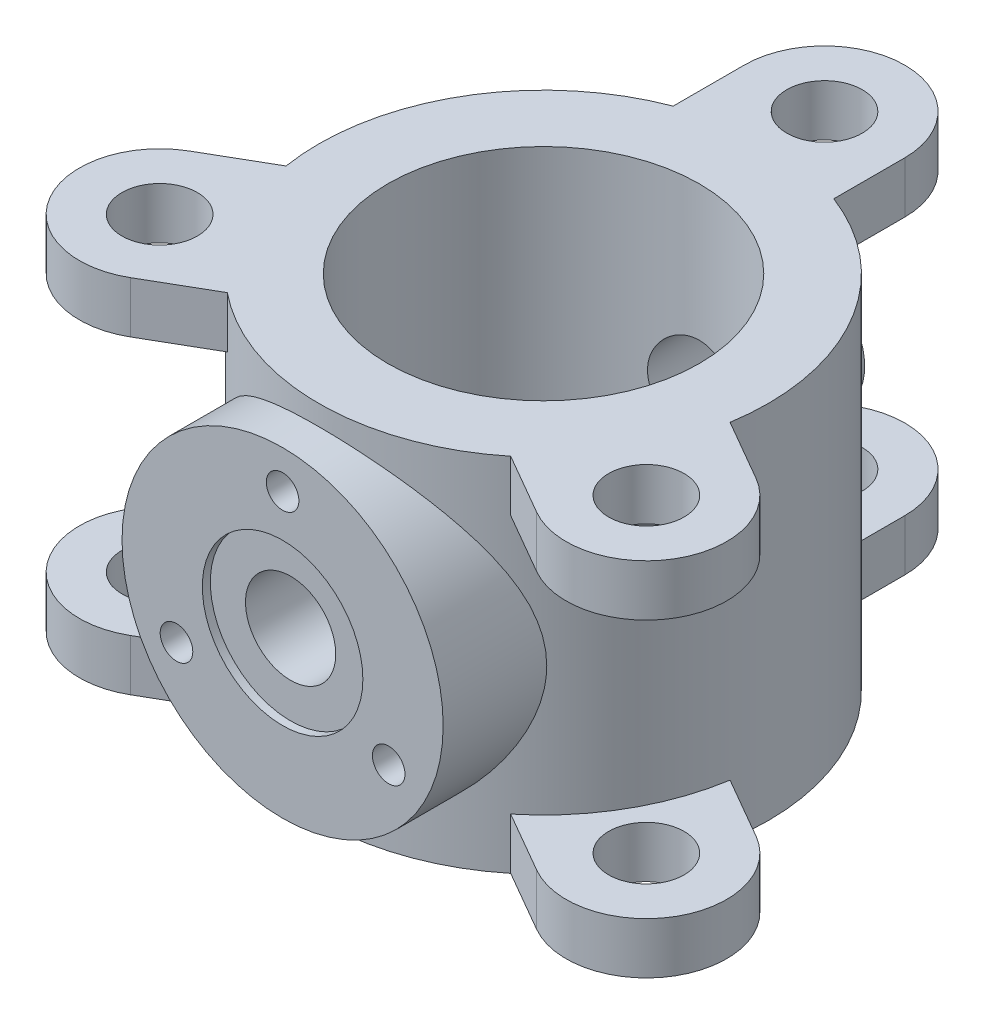
from build123d import *

# Parameters (mm, degrees)
SKETCH1_R                = 140
SKETCH1_R_2              = 97
BOSS_EXTRUDE1_DEPTH      = 112.5
BOSS_EXTRUDE2_REACH      = 353.799
BOSS_EXTRUDE2_END_RADIUS = 140
SKETCH2_R                = 100
BOSS_EXTRUDE3_REACH      = 373.324
BOSS_EXTRUDE3_END_RADIUS = 140
SKETCH3_R                = 37.5
HOLE1_D                  = 20.3
HOLE1_DEPTH              = 30
CIRPATTERN1_COUNT        = 3
HOLE2_D                  = 56.2
HOLE2_DEPTH              = 310
HOLE2_CBORE_D            = 100
HOLE2_CBORE_DEPTH        = 5
BOSS_EXTRUDE4_DEPTH      = 32
CIRPATTERN2_COUNT        = 3
SKETCH10_W               = 23.5
SKETCH10_H               = 32
HOLE3_AT_2_COUNT         = 2
HOLE3_AT_2_PITCH         = 303.108891325
HOLE3_AT_3_COUNT         = 2
HOLE3_AT_3_PITCH         = 303.108891325
MIRROR1_COPY_1_DEPTH     = 32
MIRROR1_COPY_2_DEPTH     = 32
MIRROR1_COPY_3_SKETCH_W  = 23.5
MIRROR1_COPY_3_SKETCH_H  = 32
MIRROR1_COPY_4_SKETCH_W  = 23.5
MIRROR1_COPY_4_SKETCH_H  = 32


with BuildPart() as part:
    # Sketch1 → Boss-Extrude1 (new, symmetric)
    with BuildSketch(Plane(origin=(0, 0, 0), x_dir=(1, 0, 0), z_dir=(0, 1, 0))):
        with Locations(Location((0, 0, 0), (0, 0, 270))):
            Circle(SKETCH1_R)
        with Locations(Location((0, 0, 0), (0, 0, 270))):
            Circle(SKETCH1_R_2, mode=Mode.SUBTRACT)
    extrude(amount=BOSS_EXTRUDE1_DEPTH, both=True)

    # Boss-Extrude2: up to this cylinder (the profile starts outside it)
    boss_extrude2_end = Plane(origin=(0, 0, 0), z_dir=(0, -1, 0)) * Cylinder(BOSS_EXTRUDE2_END_RADIUS, 988.598, mode=Mode.PRIVATE)
    # Sketch2 → Boss-Extrude2 (add, up to the surface)
    with BuildSketch(Plane.XY.offset(162.5), mode=Mode.PRIVATE) as boss_extrude2_sk1:
        Circle(SKETCH2_R)
    boss_extrude2_tool1 = extrude(boss_extrude2_sk1.sketch, amount=-BOSS_EXTRUDE2_REACH, mode=Mode.PRIVATE) - boss_extrude2_end
    add(boss_extrude2_tool1.solids().sort_by_distance((0, 0, 162.5))[0])

    # Boss-Extrude3: up to this cylinder (the profile starts outside it)
    boss_extrude3_end = Plane(origin=(0, 0, 0), z_dir=(0, -1, 0)) * Cylinder(BOSS_EXTRUDE3_END_RADIUS, 1027.648, mode=Mode.PRIVATE)
    # Sketch3 → Boss-Extrude3 (add, up to the surface)
    with BuildSketch(Plane.XY.offset(-162.5), mode=Mode.PRIVATE) as boss_extrude3_sk1:
        with Locations(Location((0, 0, 0), (0, 0, 90))):
            Circle(SKETCH3_R)
    boss_extrude3_tool1 = extrude(boss_extrude3_sk1.sketch, amount=BOSS_EXTRUDE3_REACH, mode=Mode.PRIVATE) - boss_extrude3_end
    add(boss_extrude3_tool1.solids().sort_by_distance((0, 0, -162.5))[0])

    # Hole1
    with Locations(Plane.XY.offset(162.5)):
        with Locations((0, 76.3)):
            hole1 = Hole(HOLE1_D / 2, depth=HOLE1_DEPTH)

    # CirPattern1: Hole1 ×3 about axis
    cirpattern1_axis = Axis((0, 0, 0), (0, 0, 1))
    for i in range(1, CIRPATTERN1_COUNT):
        add(hole1.rotate(cirpattern1_axis, i * 360 / CIRPATTERN1_COUNT), mode=Mode.SUBTRACT)

    # Hole2
    with Locations(Plane.XY.offset(162.5)):
        with Locations((0, 0)):
            CounterBoreHole(HOLE2_D / 2, HOLE2_CBORE_D / 2, HOLE2_CBORE_DEPTH, depth=HOLE2_DEPTH)

    # Sketch8 → Boss-Extrude4 (add)
    with BuildSketch(Plane(origin=(0, 112.5, 0), x_dir=(1, 0, 0), z_dir=(0, 1, 0))):
        with BuildLine():
            Line((-50, 175), (-50, 130.766968306))
            ThreePointArc((-50, 130.766968306), (0, 140), (50, 130.766968306))
            Line((50, 130.766968306), (50, 175))
            ThreePointArc((50, 175), (0, 225), (-50, 175))
        make_face()
    boss_extrude4 = extrude(amount=-BOSS_EXTRUDE4_DEPTH)

    # CirPattern2: Boss-Extrude4 ×3 about axis
    cirpattern2_axis = Axis((0, 0, 0), (0, 1, 0))
    for i in range(1, CIRPATTERN2_COUNT):
        add(boss_extrude4.rotate(cirpattern2_axis, i * 360 / CIRPATTERN2_COUNT))

    # Sketch10 → Hole3 (revolve, cut)
    with BuildSketch(Plane(origin=(0, 112.5, -175), x_dir=(0, 0, 1), z_dir=(1, 0, 0))):
        with Locations((11.75, 16)):
            Rectangle(SKETCH10_W, SKETCH10_H)
    hole3 = revolve(axis=Axis((0, 2.5, -175), (0, 1, 0)), mode=Mode.SUBTRACT)

    # Hole3 at 2: Hole3 ×2
    with Locations(*[Vector(-0.49999999999999806, 0, 0.8660254037844397) * (i * HOLE3_AT_2_PITCH) for i in range(1, HOLE3_AT_2_COUNT)]):
        add(hole3, mode=Mode.SUBTRACT)

    # Hole3 at 3: Hole3 ×2
    with Locations(*[Vector(0.500000000000004, 0, 0.8660254037844364) * (i * HOLE3_AT_3_PITCH) for i in range(1, HOLE3_AT_3_COUNT)]):
        add(hole3, mode=Mode.SUBTRACT)

    # Mirror1: Boss-Extrude4, Hole3 across plane
    add(boss_extrude4.mirror(Plane.ZX))
    add(hole3.mirror(Plane.ZX), mode=Mode.SUBTRACT)

    # Mirror1 copy 1 sketch → Mirror1 copy 1 (add)
    with BuildSketch(Plane(origin=(0, -112.5, 0), x_dir=(-0.4999999999999998, 0, -0.8660254037844387), z_dir=(0, -1, 0))):
        with BuildLine():
            Line((-50, -175), (-50, -130.766968306))
            ThreePointArc((-50, -130.766968306), (0, -140), (50, -130.766968306))
            Line((50, -130.766968306), (50, -175))
            ThreePointArc((50, -175), (0, -225), (-50, -175))
        make_face()
    extrude(amount=-MIRROR1_COPY_1_DEPTH)

    # Mirror1 copy 2 sketch → Mirror1 copy 2 (add)
    with BuildSketch(Plane(origin=(0, -112.5, 0), x_dir=(-0.5000000000000004, 0, 0.8660254037844384), z_dir=(0, -1, 0))):
        with BuildLine():
            Line((-50, -175), (-50, -130.766968306))
            ThreePointArc((-50, -130.766968306), (0, -140), (50, -130.766968306))
            Line((50, -130.766968306), (50, -175))
            ThreePointArc((50, -175), (0, -225), (-50, -175))
        make_face()
    extrude(amount=-MIRROR1_COPY_2_DEPTH)

    # Mirror1 copy 3 sketch → Mirror1 copy 3 (revolve, cut)
    with BuildSketch(Plane(origin=(-151.554445662, -112.5, 87.5), x_dir=(0, 0, 1), z_dir=(1, 0, 0))):
        with Locations((11.75, -16)):
            Rectangle(MIRROR1_COPY_3_SKETCH_W, MIRROR1_COPY_3_SKETCH_H)
    revolve(axis=Axis((-151.554445662, -2.5, 87.5), (0, 1, 0)), mode=Mode.SUBTRACT)

    # Mirror1 copy 4 sketch → Mirror1 copy 4 (revolve, cut)
    with BuildSketch(Plane(origin=(151.554445662, -112.5, 87.5), x_dir=(0, 0, 1), z_dir=(1, 0, 0))):
        with Locations((11.75, -16)):
            Rectangle(MIRROR1_COPY_4_SKETCH_W, MIRROR1_COPY_4_SKETCH_H)
    revolve(axis=Axis((151.554445662, -2.5, 87.5), (0, 1, 0)), mode=Mode.SUBTRACT)


solid = part.part
